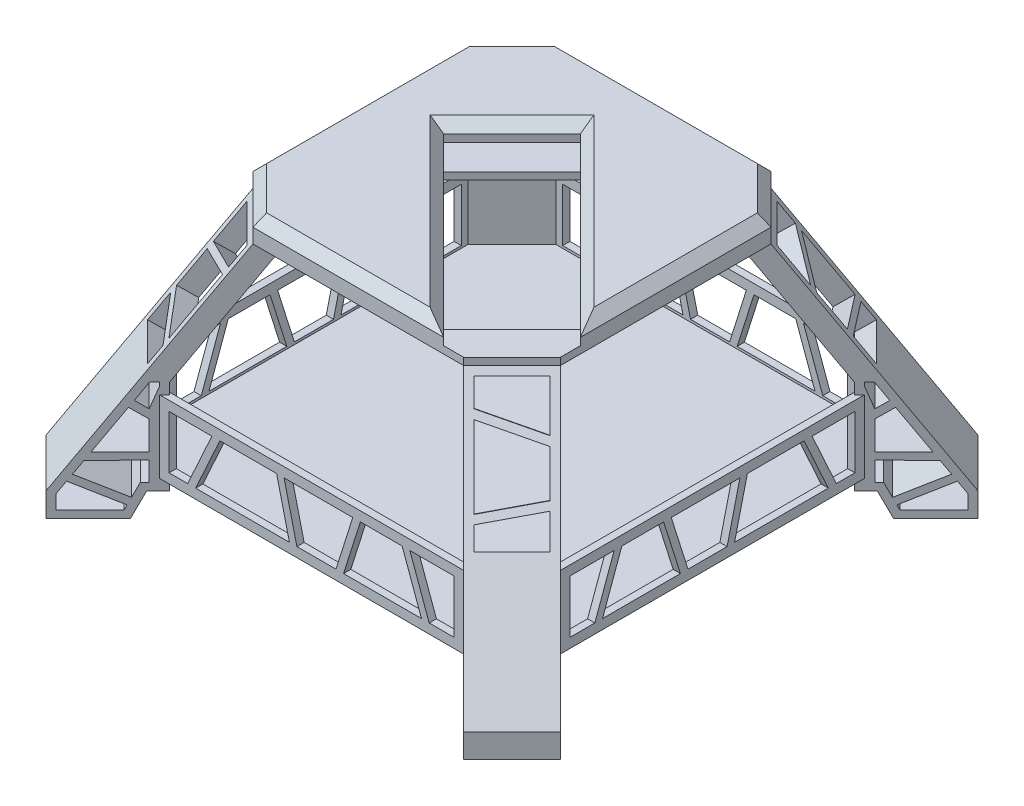
from build123d import *
from build123d.topology import SkipClean

# Parameters (mm, degrees)
BOSS_EXTRUDE1_DEPTH      = 15
SHELL1_T                 = -1.5
CUT_EXTRUDE3_DEPTH       = 95.00132977782815
BOSS_EXTRUDE2_DEPTH      = 7.071068
BOSS_EXTRUDE2_DEPTH_BACK = 7.071068
BOSS_EXTRUDE4_DEPTH      = 30
CUT_EXTRUDE1_REACH       = 112.913
CUT_EXTRUDE2_DEPTH       = 14.142136
BOSS_EXTRUDE5_DEPTH      = 5
BOSS_EXTRUDE6_DEPTH      = 1.5
CHAMFER1_SIZE            = 2


with BuildPart() as part:
    # Sketch1 → Boss-Extrude1 (new body)
    with BuildSketch(Plane(origin=(0, 0, 0), x_dir=(1, 0, 0), z_dir=(0, 1, 0))):
        Polygon((-31.5, 41.5), (-41.5, 31.500000000000007), (-41.499999999999986, -31.5), (-31.499999999999993, -41.5), (31.5, -41.5), (41.50000000000001, -31.5), (41.5, 31.5), (31.5, 41.5), align=None)
    extrude(amount=BOSS_EXTRUDE1_DEPTH)

    # Shell1
    shell1_openings = [part.faces().sort_by_distance(p)[0] for p in [
        (0, 15, 0),
    ]]
    offset(amount=SHELL1_T, openings=shell1_openings, kind=Kind.INTERSECTION)

    # Sketch15 → Cut-Extrude3 (cut, through all)
    with BuildSketch(Plane(origin=(41.50000000000001, 0, -4.57e-15), x_dir=(-1.1e-16, 0, -1), z_dir=(1, 0, -1.1e-16))):
        Polygon((18.993371063166524, 13), (7.2371067051769185, 13.000000000000002), (4.58561241042752, 2), (24.00131149898392, 2), align=None)
        Polygon((25.64944794139587, 2.0000000000000004), (29.499999999999993, 2), (29.499999999999993, 13), (20.64150750557847, 13.000000000000002), align=None)
        Polygon((-24.347824802464714, 2), (-20.349378171681945, 13), (-29.500000000000007, 13), (-29.500000000000007, 2), align=None)
        Polygon((-22.75180173674549, 2), (-18.75335510596273, 13), (-10.100748478512307, 13.000000000000002), (-6.627365085332172, 2), align=None)
        Polygon((-8.52774565861223, 13.000000000000002), (-5.054362265432096, 2), (3.04265065214834, 2), (5.6941449468977385, 13.000000000000002), align=None)
    cut_extrude3 = extrude(amount=-CUT_EXTRUDE3_DEPTH, mode=Mode.SUBTRACT)

    # Mirror4: Cut-Extrude3 across plane
    add(cut_extrude3.mirror(Plane(origin=(0, 0, 0), x_dir=(0.7071067811865476, 0, 0.7071067811865476), z_dir=(-0.7071067811865477, 0, 0.7071067811865475))), mode=Mode.SUBTRACT)


with BuildPart() as body_2:
    # Sketch2 → Boss-Extrude2 (new, two sides: drawn at the far end of the back side and taken through both)
    with BuildSketch(Plane(origin=(0, 0, 0), x_dir=(0.7071067811865475, 0, 0.7071067811865477), z_dir=(-0.7071067811865477, 0, 0.7071067811865475)).offset(-BOSS_EXTRUDE2_DEPTH_BACK)):
        Polygon((51.61879502661797, 15), (50.118795026617974, 15), (50.118795026617974, 17.28216601854043), (54.873004899604894, 17.28216601854043), (68.22932448915253, -2.229104461714619), (68.22932448915253, -7.154671666935144), (55.850767878780516, -7.154671666935144), (53.48270672243416, -2.229104461714619), (50.118795026617974, -2.22910446171462), (50.118795026617974, 0), (51.61879502661797, 0), align=None)
    extrude(amount=BOSS_EXTRUDE2_DEPTH + BOSS_EXTRUDE2_DEPTH_BACK)

    # Sketch6 → Boss-Extrude4 (add, along a direction that is not the sketch's normal)
    with SkipClean():  # the faces are left unmerged after this step: merging them gives an invalid solid
        with BuildSketch(Plane(origin=(0, 17.28216601854043, 0), x_dir=(1, 0, 0), z_dir=(0, 1, 0))):
            Polygon((33.801073868593264, -43.80107386859327), (43.80107386859327, -33.801073868593264), (40.439339828220184, -30.43933982822017), (30.439339828220177, -40.43933982822018), align=None)
        extrude(amount=BOSS_EXTRUDE4_DEPTH, dir=(-0.3994242769765721, 0.825179067792855, -0.3994242769765721))

    # Cut-Extrude1: up to this face of the body (flat: up to its plane)
    cut_extrude1_end = Plane(body_2.part.faces().sort_by_distance((29.447975674, 29.659852035, 29.447975674))[0])
    # Sketch8 → Cut-Extrude1 (cut, up to the picked face)
    with BuildSketch(Plane(origin=(32.11658872331518, 31.09178536017919, 32.11658872331519), x_dir=(0.8089878292293696, -0.46732732726251774, -0.35657237884113224), z_dir=(0.5834897145295215, 0.5648712296413361, 0.5834897145295215)), mode=Mode.PRIVATE) as cut_extrude1_sk1:
        Polygon((-2.07121700432942, 12.85126531725861), (-11.254292504010886, 6.541090151325048), (-8.528640247111099, 2.5745013003347554), (2.888274723825527, 5.633813220910234), align=None)
    cut_extrude1_tool1 = split(extrude(cut_extrude1_sk1.sketch, amount=-CUT_EXTRUDE1_REACH, mode=Mode.PRIVATE), bisect_by=cut_extrude1_end, keep=Keep.BOTH, mode=Mode.PRIVATE)
    # Sketch8 → Cut-Extrude1 (cut, up to the picked face)
    with BuildSketch(Plane(origin=(32.11658872331518, 31.09178536017919, 32.11658872331519), x_dir=(0.8089878292293696, -0.46732732726251774, -0.35657237884113224), z_dir=(0.5834897145295215, 0.5648712296413361, 0.5834897145295215)), mode=Mode.PRIVATE) as cut_extrude1_sk2:
        Polygon((-7.627479447469721, 1.263059471407999), (0.23692235086833668, -10.181851893946245), (8.28732896569187, -2.2233256739969747), (3.789435523466912, 4.32237139198348), align=None)
    cut_extrude1_tool2 = split(extrude(cut_extrude1_sk2.sketch, amount=-CUT_EXTRUDE1_REACH, mode=Mode.PRIVATE), bisect_by=cut_extrude1_end, keep=Keep.BOTH, mode=Mode.PRIVATE)
    # Sketch8 → Cut-Extrude1 (cut, up to the picked face)
    with BuildSketch(Plane(origin=(32.11658872331518, 31.09178536017919, 32.11658872331519), x_dir=(0.8089878292293696, -0.46732732726251774, -0.35657237884113224), z_dir=(0.5834897145295215, 0.5648712296413361, 0.5834897145295215)), mode=Mode.PRIVATE) as cut_extrude1_sk3:
        Polygon((3.3653386852536813, -14.734575493156704), (12.548414184935151, -8.42440032722314), (9.150407530361377, -3.4793471651760046), (1.1000009155378394, -11.437873385125275), align=None)
    cut_extrude1_tool3 = split(extrude(cut_extrude1_sk3.sketch, amount=-CUT_EXTRUDE1_REACH, mode=Mode.PRIVATE), bisect_by=cut_extrude1_end, keep=Keep.BOTH, mode=Mode.PRIVATE)
    add(cut_extrude1_tool1.solids().sort_by(Axis((29.192371, 37.921515, 28.429006), (-0.5834897145295215, -0.5648712296413361, -0.5834897145295215)))[0], mode=Mode.SUBTRACT)
    add(cut_extrude1_tool2.solids().sort_by(Axis((32.567648, 29.421183, 33.282824), (-0.5834897145295215, -0.5648712296413361, -0.5834897145295215)))[0], mode=Mode.SUBTRACT)
    add(cut_extrude1_tool3.solids().sort_by(Axis((36.979161, 21.588652, 36.453916), (-0.5834897145295215, -0.5648712296413361, -0.5834897145295215)))[0], mode=Mode.SUBTRACT)

    # Sketch12 → Cut-Extrude2 (cut)
    with SkipClean():  # the faces are left unmerged after this step: merging them gives an invalid solid
        with BuildSketch(Plane(origin=(-5.000000000000001, 0, 5), x_dir=(0.7071067811865498, 0, 0.7071067811865452), z_dir=(-0.7071067811865452, 0, 0.7071067811865498))):
            Polygon((56.36067018277169, -4.75341924240927), (65.22291058938286, -0.4927267392482123), (66.72932448915253, -2.693336634553762), (66.72932448915253, -5.654671666935144), (56.79396461763814, -5.654671666935146), align=None)
            Polygon((51.61879502661796, 17.28216601854043), (53.05521763554823, 17.28216601854043), (55.31470255411357, 13.981449747369009), (53.11879502661796, 12.478254824413833), (51.61879502661796, 16.5), align=None)
            Polygon((53.11879502661796, 10.660467560357171), (56.16200939857558, 12.743681145679732), (61.641621447532906, 4.7389166521930886), (53.11879502661796, 4.77090610417446), align=None)
            Polygon((53.11879502661796, 3.270895538285381), (62.67108947805448, 3.235042096061534), (64.36570316697849, 0.7595048926829704), (55.71072853047203, -3.401540605620465), (54.42590346129178, -0.7291044617146178), (53.11879502661796, -0.729104461714619), align=None)
        extrude(amount=-CUT_EXTRUDE2_DEPTH, mode=Mode.SUBTRACT)


with BuildPart() as body_3:
    # Mirror1: mirrored copy
    add(body_2.part.mirror(Plane.ZY))


with BuildPart() as body_4:
    # Mirror2: mirrored copy
    add(body_3.part.mirror(Plane(origin=(0, 0, 0), x_dir=(1, 0, 0), z_dir=(0, 0, -1))))


with BuildPart() as body_5:
    # Mirror2 2: mirrored copy
    add(body_2.part.mirror(Plane(origin=(0, 0, 0), x_dir=(1, 0, 0), z_dir=(0, 0, -1))))


with BuildPart() as body_3_1:
    with SkipClean():  # the faces are left unmerged after this step: merging them gives an invalid solid
        add(body_3.part)

        add(body_4.part)  # Boss-Extrude5 merges body 4

        add(body_5.part)  # Boss-Extrude5 merges body 5
        # Sketch7 → Boss-Extrude5 (add)
        with BuildSketch(Plane(origin=(0, 42.03753805232608, 0), x_dir=(1, 0, 0), z_dir=(0, 1, 0))):
            Polygon((-31.8183455592961, 21.818345559296105), (-31.8183455592961, -21.818345559296105), (-21.81834555929609, -31.818345559296116), (17.676209935565144, -31.81834555929611), (14.778531726798828, -28.920667350529794), (-13.50573952066306, -0.636396103067888), (-18.809040379562166, 4.666904755831226), (-4.66690475583121, 18.80904037956217), (0.6363961030678986, 13.505739520663058), (28.920667350529783, -14.778531726798853), (31.818345559296105, -17.676209935565176), (31.81834555929611, 21.818345559296098), (21.818345559296098, 31.81834555929611), (-21.81834555929609, 31.818345559296116), align=None)
        extrude(amount=BOSS_EXTRUDE5_DEPTH)


with BuildPart() as body_2_1:
    with SkipClean():  # the faces are left unmerged after this step: merging them gives an invalid solid
        add(body_2.part)

        add(body_3_1.part)  # Boss-Extrude6 merges body 3
        # Sketch7<3> → Boss-Extrude6 (add)
        with BuildSketch(Plane(origin=(0, 42.03753805232608, 0), x_dir=(1, 0, 0), z_dir=(0, 1, 0))):
            Polygon((14.778531726798828, -28.920667350529794), (17.676209935565144, -31.81834555929611), (21.818345559296098, -31.81834555929611), (31.81834555929611, -21.818345559296098), (31.81834555929611, -17.676209935565176), (28.920667350529783, -14.778531726798853), align=None)
            Polygon((-18.809040379562166, 4.666904755831226), (-13.50573952066306, -0.636396103067888), (0.6363961030678986, 13.505739520663058), (-4.66690475583121, 18.80904037956217), align=None)
        extrude(amount=BOSS_EXTRUDE6_DEPTH)

    # Chamfer1
    chamfer1_edges = [body_2_1.edges().sort_by_distance(p)[0] for p in [
        (-2.0710678118654684, 47.03753805232608, 31.818345559296112),
        (31.81834555929611, 47.03753805232608, -2.0710678118654613),
        (26.818345559296105, 47.03753805232608, -26.818345559296105),
        (3.55e-15, 47.03753805232608, -31.818345559296112),
        (-26.818345559296098, 47.03753805232608, -26.818345559296112),
        (-31.8183455592961, 47.03753805232608, 0),
        (-26.818345559296098, 47.03753805232608, 26.818345559296112),
        (-0.5664152219985112, 47.03753805232608, 13.575720401732442),
        (-11.737972567696687, 47.03753805232608, -11.737972567696698),
        (13.575720401732447, 47.03753805232608, -0.566415221998497),
    ]]
    chamfer(chamfer1_edges, length=CHAMFER1_SIZE)


solid = Compound([part.part, body_2_1.part])
